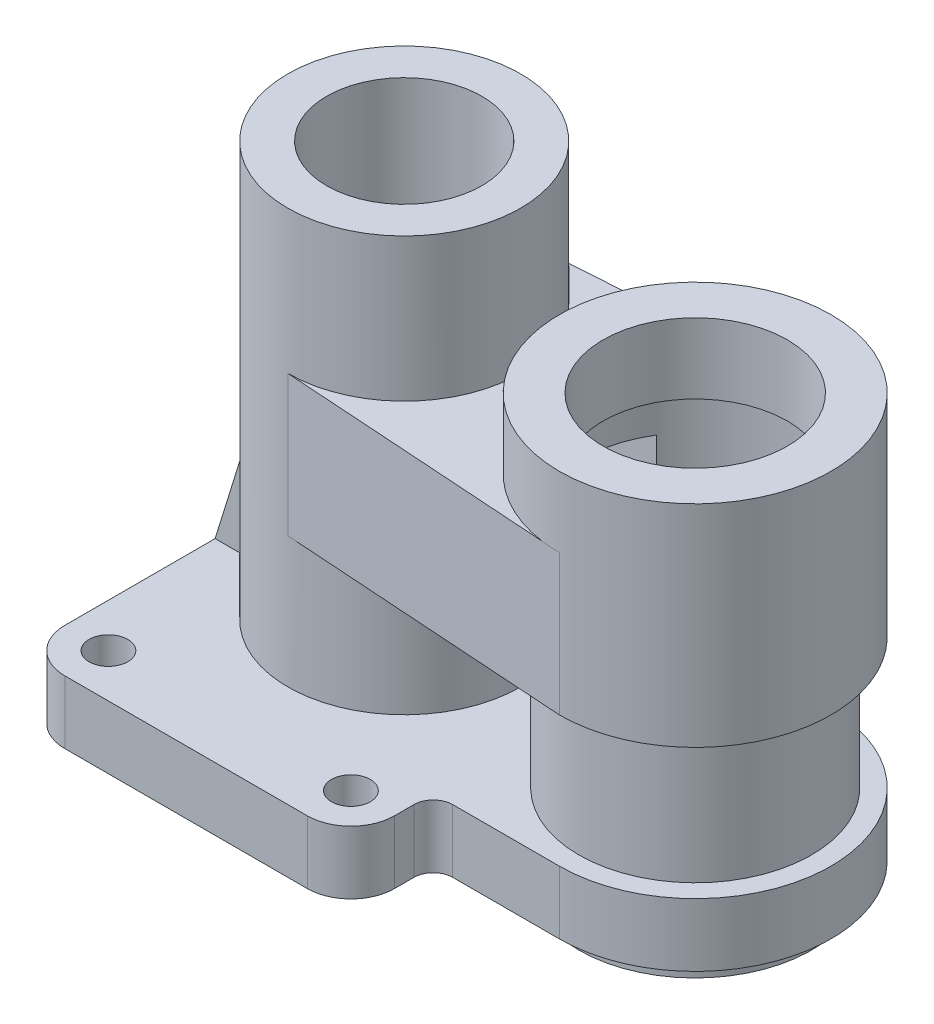
from build123d import *

# Parameters (mm, degrees)
BOSS_EXTRUDE1_DEPTH       = 13
FILLET2_R                 = 4
FILLET3_R                 = 9
SKETCH5_R                 = 4
CUT_EXTRUDE1_DEPTH        = 100.689518005
SKETCH6_R                 = 24
SKETCH6_R_2               = 16
BOSS_EXTRUDE2_DEPTH       = 41.064418341
SKETCH7_R                 = 24
SKETCH7_R_2               = 19
BOSS_EXTRUDE3_DEPTH       = 17
BOSS_EXTRUDE4_START       = 28
SKETCH7_2_R               = 24
SKETCH7_2_R_2             = 19
BOSS_EXTRUDE4_DEPTH       = 28
BOSS_EXTRUDE11_DEPTH      = 28
BOSS_EXTRUDE11_DEPTH_BACK = 1
SKETCH8_R                 = 24
SKETCH8_R_2               = 16
SKETCH9_W                 = 95
SKETCH9_H                 = 12
CUT_EXTRUDE2_DEPTH        = 12.5
SKETCH10_R                = 24
SKETCH10_R_2              = 16
BOSS_EXTRUDE12_DEPTH      = 29.5
SKETCH12_R                = 28
SKETCH12_R_2              = 19
BOSS_EXTRUDE13_DEPTH      = 14.5
RIB1_REACH                = 141.539
SKETCH13_WALL_W           = 318.21240823
SKETCH13_WALL_H           = 10
SKETCH15_R                = 15.829166104
SKETCH15_R_2              = 19
CUT_EXTRUDE5_DEPTH        = 140.539420953


with BuildPart() as part:
    # Sketch3 → Boss-Extrude1 (new body)
    with BuildSketch(Plane(origin=(0, 0, 0), x_dir=(1, 0, 0), z_dir=(0, 1, 0))):
        with BuildLine():
            Line((34, -45), (34, -28))
            Line((34, -28), (60, -28))
            ThreePointArc((60, -28), (88, 0), (60, 28))
            Line((60, 28), (34, 28))
            Line((34, 28), (34, 45))
            Line((34, 45), (-34, 45))
            Line((-34, 45), (-34, -45))
            Line((-34, -45), (34, -45))
        make_face()
    extrude(amount=BOSS_EXTRUDE1_DEPTH)

    # Fillet2
    fillet2_edges = [part.edges().sort_by_distance(p)[0] for p in [
        (34, 6.5, -28),
        (34, 6.5, 28),
    ]]
    fillet(fillet2_edges, radius=FILLET2_R)

    # Fillet3
    fillet3_edges = [part.edges().sort_by_distance(p)[0] for p in [
        (-34, 6.5, 45),
        (34, 6.5, 45),
        (34, 6.5, -45),
        (-34, 6.5, -45),
    ]]
    fillet(fillet3_edges, radius=FILLET3_R)

    # Sketch5 → Cut-Extrude1 (cut, through all)
    with BuildSketch(Plane(origin=(0, 13, 0), x_dir=(1, 0, 0), z_dir=(0, 1, 0))):
        with Locations((-25, 36)):
            Circle(SKETCH5_R)
        with Locations((25, 36)):
            Circle(SKETCH5_R)
        with Locations((-25, -36)):
            Circle(SKETCH5_R)
        with Locations((25, -36)):
            Circle(SKETCH5_R)
    extrude(amount=-CUT_EXTRUDE1_DEPTH, mode=Mode.SUBTRACT)

    # Sketch6 → Boss-Extrude2 (add)
    with BuildSketch(Plane(origin=(0, 0, 0), x_dir=(1, 0, 0), z_dir=(0, 1, 0))):
        Circle(SKETCH6_R)
        Circle(SKETCH6_R_2, mode=Mode.SUBTRACT)
    extrude(amount=BOSS_EXTRUDE2_DEPTH)

    # Sketch7 → Boss-Extrude3 (add)
    with BuildSketch(Plane(origin=(0, 13, 0), x_dir=(1, 0, 0), z_dir=(0, 1, 0))):
        with Locations((60, 0)):
            Circle(SKETCH7_R)
        with Locations((60, 0)):
            Circle(SKETCH7_R_2, mode=Mode.SUBTRACT)
    extrude(amount=-BOSS_EXTRUDE3_DEPTH)

    # Sketch7<2> → Boss-Extrude4 (add)
    with BuildSketch(Plane(origin=(0, 13, 0), x_dir=(1, 0, 0), z_dir=(0, 1, 0)).offset(BOSS_EXTRUDE4_START)):
        with Locations((60, 0)):
            Circle(SKETCH7_2_R)
        with Locations((60, 0)):
            Circle(SKETCH7_2_R_2, mode=Mode.SUBTRACT)
    extrude(amount=-BOSS_EXTRUDE4_DEPTH)

    # Sketch8 → Boss-Extrude11 (add, two sides: drawn at the far end of the back side and taken through both)
    with BuildSketch(Plane(origin=(0, 41, 0), x_dir=(1, 0, 0), z_dir=(0, 1, 0)).offset(-BOSS_EXTRUDE11_DEPTH_BACK)):
        with BuildLine():
            ThreePointArc((0, 24), (-24, 0), (0, -24))
            Line((0, -24), (60, -28))
            ThreePointArc((60, -28), (88, 0), (60, 28))
            Line((60, 28), (0, 24))
        make_face()
        with Locations((60, 0)):
            Circle(SKETCH8_R, mode=Mode.SUBTRACT)
        Circle(SKETCH8_R_2, mode=Mode.SUBTRACT)
    extrude(amount=BOSS_EXTRUDE11_DEPTH + BOSS_EXTRUDE11_DEPTH_BACK)

    # Sketch9 → Cut-Extrude2 (cut, symmetric)
    with BuildSketch(Plane.XY):
        with Locations((31.5, 53.5)):
            Rectangle(SKETCH9_W, SKETCH9_H)
    extrude(amount=CUT_EXTRUDE2_DEPTH, both=True, mode=Mode.SUBTRACT)

    # Sketch10 → Boss-Extrude12 (add)
    with BuildSketch(Plane(origin=(0, 69, 0), x_dir=(1, 0, 0), z_dir=(0, 1, 0))):
        Circle(SKETCH10_R)
        Circle(SKETCH10_R_2, mode=Mode.SUBTRACT)
    extrude(amount=BOSS_EXTRUDE12_DEPTH)

    # Sketch12 → Boss-Extrude13 (add)
    with BuildSketch(Plane(origin=(0, 69, 0), x_dir=(1, 0, 0), z_dir=(0, 1, 0))):
        with Locations((60, 0)):
            Circle(SKETCH12_R)
        with Locations((60, 0)):
            Circle(SKETCH12_R_2, mode=Mode.SUBTRACT)
    extrude(amount=BOSS_EXTRUDE13_DEPTH)

    # Sketch13 wall → Rib1 (add, up to next)
    with BuildSketch(Plane(origin=(-28.5, 30.733455303, 0), x_dir=(0.296227943859, 0.955117273049, 0), z_dir=(-0.955117273049, 0.296227943859, 0)), mode=Mode.PRIVATE) as rib1_sk1:
        Rectangle(SKETCH13_WALL_W, SKETCH13_WALL_H)
    rib1_tool1 = extrude(rib1_sk1.sketch, amount=-RIB1_REACH, mode=Mode.PRIVATE) - part.part
    add(rib1_tool1.solids().sort_by_distance((-28.5, 30.733455303, 0))[0])

    # Sketch15 → Cut-Extrude5 (cut, through all)
    with BuildSketch(Plane(origin=(0, 0, 0), x_dir=(1, 0, 0), z_dir=(0, 1, 0))):
        Circle(SKETCH15_R)
        with Locations((60, 0)):
            Circle(SKETCH15_R_2)
    extrude(amount=CUT_EXTRUDE5_DEPTH, mode=Mode.SUBTRACT)


solid = part.part
